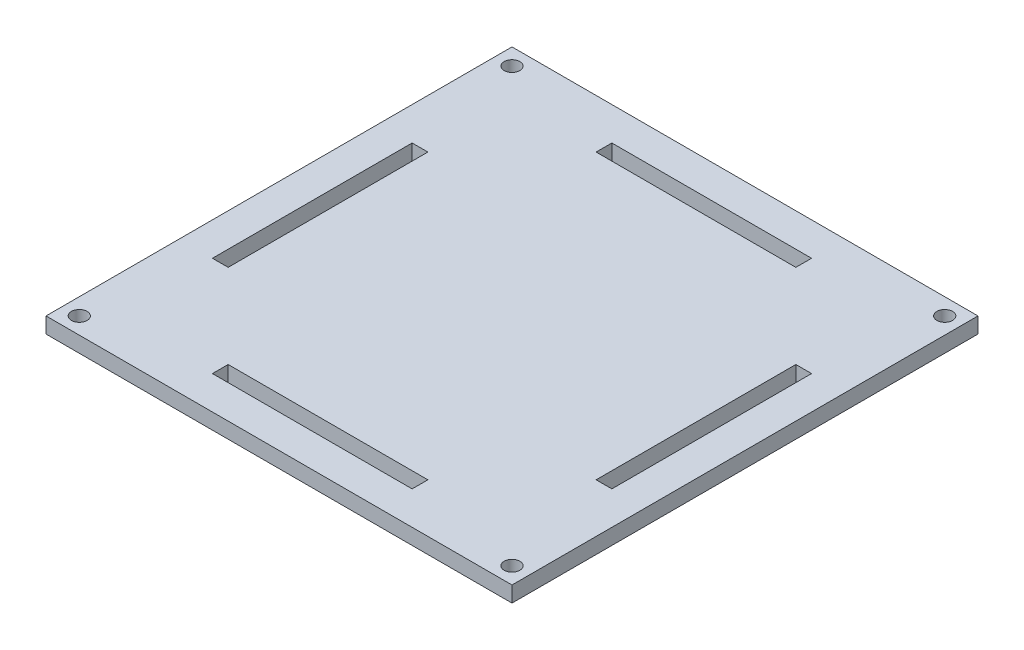
from build123d import *

# Parameters (mm, degrees)
SKETCH_2_W          = 88.9
SKETCH_2_H          = 3
EXTRUDE_1_DEPTH     = 88.9
SKETCH_4_R          = 1.5
CUT_EXTRUDE_1_DEPTH = 3
SKETCH_10_W         = 3
SKETCH_10_H         = 38.1
SKETCH_10_W_2       = 38.1
SKETCH_10_H_2       = 3
CUT_EXTRUDE_6_DEPTH = 3


with BuildPart() as part:
    # 스케치2 → 보스-돌출1 (new body)
    with BuildSketch(Plane.XY):
        Rectangle(SKETCH_2_W, SKETCH_2_H)
    extrude(amount=EXTRUDE_1_DEPTH)

    # 스케치4 → 컷-돌출1 (cut)
    with BuildSketch(Plane(origin=(0, 1.5, 0), x_dir=(1, 0, 0), z_dir=(0, 1, 0))):
        with Locations(Location((-41.275, -85.725, 0), (0, 0, 270))):
            Circle(SKETCH_4_R)
        with Locations(Location((-41.275, -3.175, 0), (0, 0, 270))):
            Circle(SKETCH_4_R)
        with Locations(Location((41.275, -3.175, 0), (0, 0, 270))):
            Circle(SKETCH_4_R)
        with Locations(Location((41.275, -85.725, 0), (0, 0, 270))):
            Circle(SKETCH_4_R)
    extrude(amount=-CUT_EXTRUDE_1_DEPTH, mode=Mode.SUBTRACT)

    # 스케치10 → 컷-돌출6 (cut)
    with BuildSketch(Plane(origin=(0, 1.5, 0), x_dir=(1, 0, 0), z_dir=(0, 1, 0))):
        with Locations((-36.6, -44.45)):
            Rectangle(SKETCH_10_W, SKETCH_10_H)
        with Locations((0, -7.85)):
            Rectangle(SKETCH_10_W_2, SKETCH_10_H_2)
        with Locations((36.6, -44.45)):
            Rectangle(SKETCH_10_W, SKETCH_10_H)
        with Locations((0, -81.05)):
            Rectangle(SKETCH_10_W_2, SKETCH_10_H_2)
    extrude(amount=-CUT_EXTRUDE_6_DEPTH, mode=Mode.SUBTRACT)


solid = part.part
